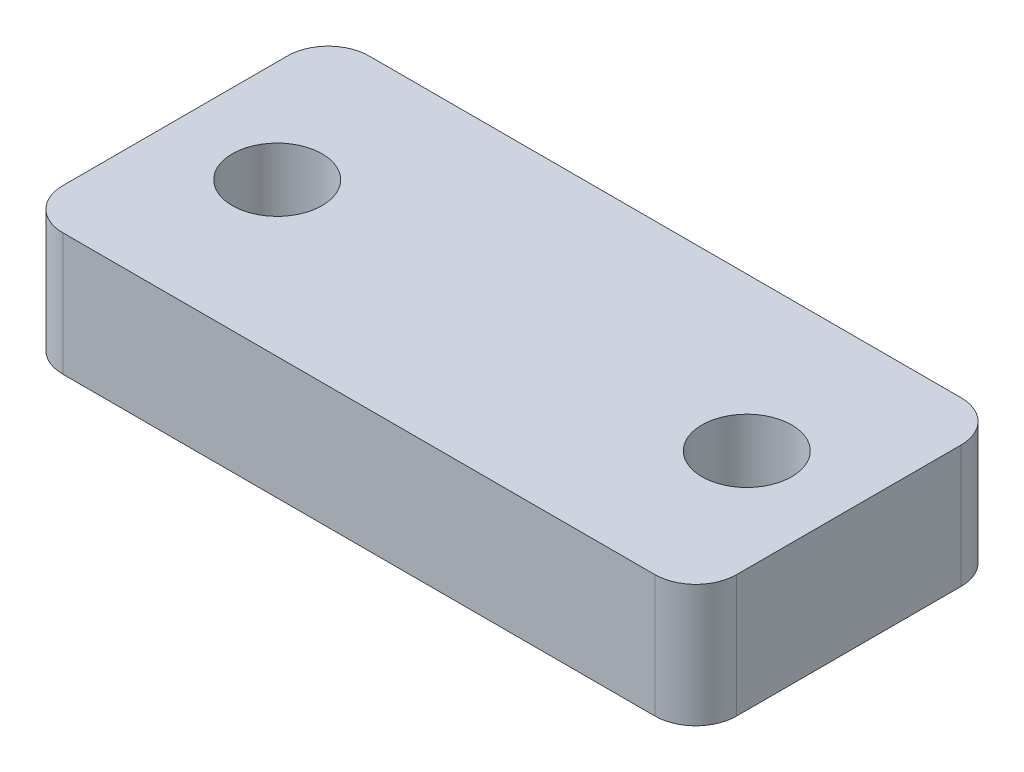
from build123d import *

# Parameters (mm, degrees)
SKETCH_1_W      = 33
SKETCH_1_H      = 15
SKETCH_1_R      = 2.2
EXTRUDE_1_DEPTH = 6
FILLET_1_R      = 2


with BuildPart() as part:
    # 草图1 → 凸台-拉伸1 (new body)
    with BuildSketch(Plane(origin=(0, 0, 0), x_dir=(1, 0, 0), z_dir=(0, 1, 0))):
        Rectangle(SKETCH_1_W, SKETCH_1_H)
        with Locations(Location((-11.5, 0, 0), (0, 0, 270))):
            Circle(SKETCH_1_R, mode=Mode.SUBTRACT)
        with Locations(Location((11.5, 0, 0), (0, 0, 90))):
            Circle(SKETCH_1_R, mode=Mode.SUBTRACT)
    extrude(amount=EXTRUDE_1_DEPTH)

    # 圆角1
    fillet_1_edges = [part.edges().sort_by_distance(p)[0] for p in [
        (16.5, 3, 7.5),
        (-16.5, 3, 7.5),
        (-16.5, 3, -7.5),
        (16.5, 3, -7.5),
    ]]
    fillet(fillet_1_edges, radius=FILLET_1_R)


solid = part.part
